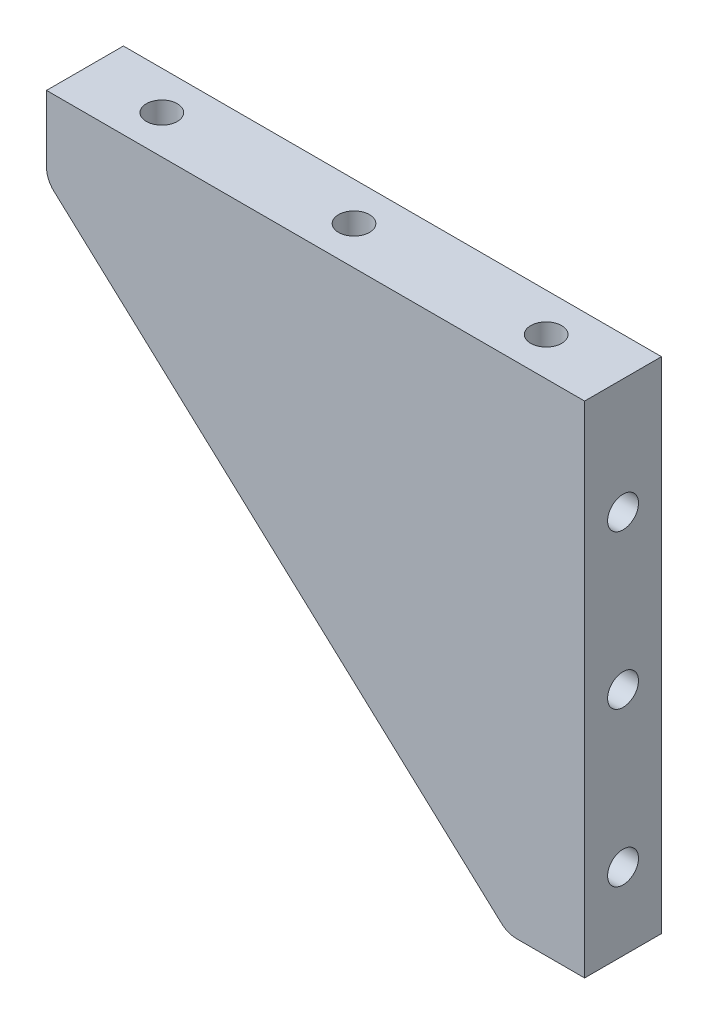
from build123d import *

# Parameters (mm, degrees)
BOSS_EXTRUDE1_DEPTH = 6.35
LPATTERN1_COUNT     = 3
LPATTERN1_PITCH     = 31.75
LPATTERN2_COUNT     = 3
LPATTERN2_PITCH     = 25.4
FILLET1_R           = 3.81


with BuildPart() as part:
    # Sketch1 → Boss-Extrude1 (new, symmetric)
    with BuildSketch(Plane.XY):
        Polygon((0, 0), (-88.9, 0), (-88.9, -12.7), (-12.7, -82.55), (0, -82.55), align=None)
    extrude(amount=BOSS_EXTRUDE1_DEPTH, both=True)

    # Sketch3 → Tap Drill for 1/4-20 Tap1 (revolve, cut)
    with BuildSketch(Plane(origin=(-76.2, 0, 0), x_dir=(0, 0, 1), z_dir=(1, 0, 0))):
        Polygon((0, 0), (0, 14.233816902), (2.5527, 12.7), (2.5527, 0), align=None)
    tap_drill_for_1_4_20_tap1 = revolve(axis=Axis((-76.2, 6.35, 0), (0, -1, 0)), mode=Mode.SUBTRACT)

    # LPattern1: Tap Drill for 1/4-20 Tap1 ×3
    with Locations(*[(i * LPATTERN1_PITCH, 0, 0) for i in range(1, LPATTERN1_COUNT)]):
        add(tap_drill_for_1_4_20_tap1, mode=Mode.SUBTRACT)

    # Sketch5 → Tap Drill for 1/4-20 Tap2 (revolve, cut)
    with BuildSketch(Plane(origin=(0, -69.85, 0), x_dir=(0, 0, -1), z_dir=(0, 1, 0))):
        Polygon((0, 0), (0, 14.233816902), (2.5527, 12.7), (2.5527, 0), align=None)
    tap_drill_for_1_4_20_tap2 = revolve(axis=Axis((6.35, -69.85, 0), (-1, 0, 0)), mode=Mode.SUBTRACT)

    # LPattern2: Tap Drill for 1/4-20 Tap2 ×3
    with Locations(*[(0, i * LPATTERN2_PITCH, 0) for i in range(1, LPATTERN2_COUNT)]):
        add(tap_drill_for_1_4_20_tap2, mode=Mode.SUBTRACT)

    # Fillet1
    fillet1_edges = [part.edges().sort_by_distance(p)[0] for p in [
        (-12.7, -82.55, 0),
        (-88.9, -12.7, 0),
    ]]
    fillet(fillet1_edges, radius=FILLET1_R)


solid = part.part
